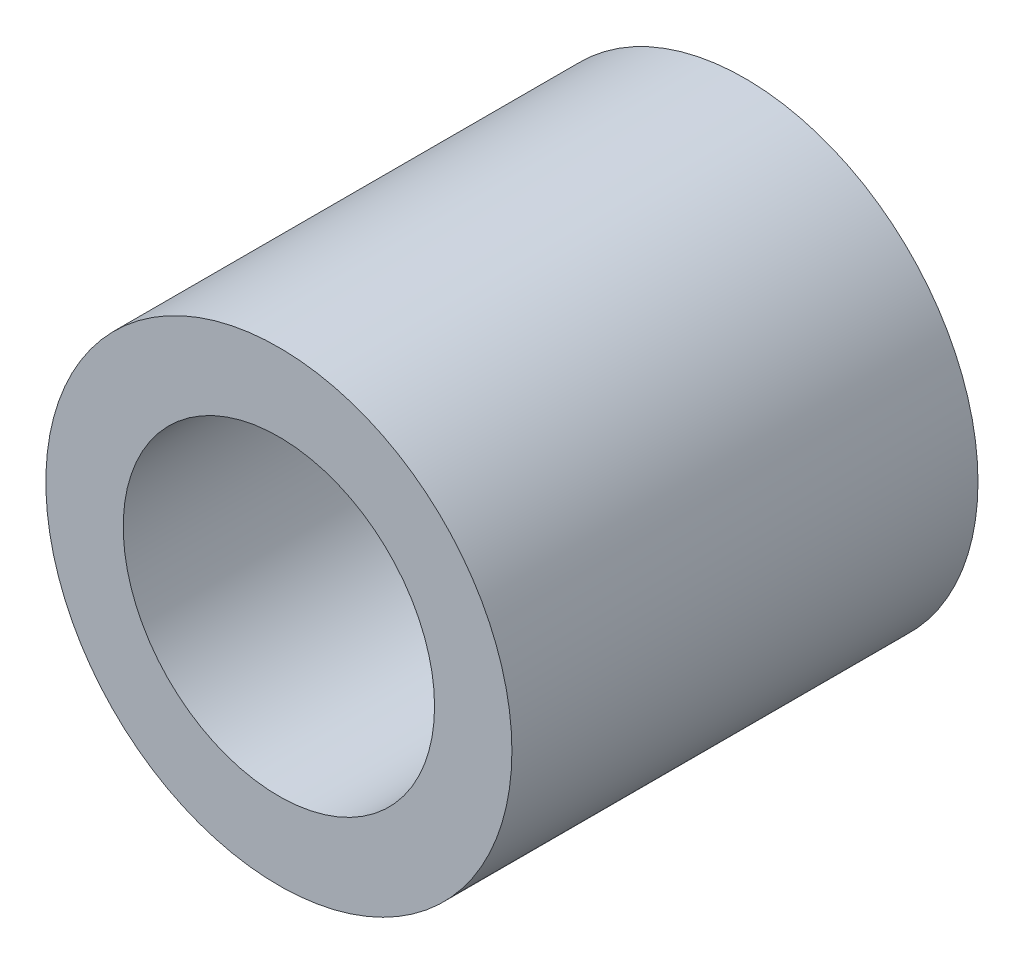
from build123d import *

# Parameters (mm, degrees)
SKETCH1_R           = 1.25
SKETCH1_R_2         = 0.835
BOSS_EXTRUDE1_DEPTH = 2.5


with BuildPart() as part:
    # Sketch1 → Boss-Extrude1 (new body)
    with BuildSketch(Plane.XY):
        Circle(SKETCH1_R)
        Circle(SKETCH1_R_2, mode=Mode.SUBTRACT)
    extrude(amount=BOSS_EXTRUDE1_DEPTH)


solid = part.part
